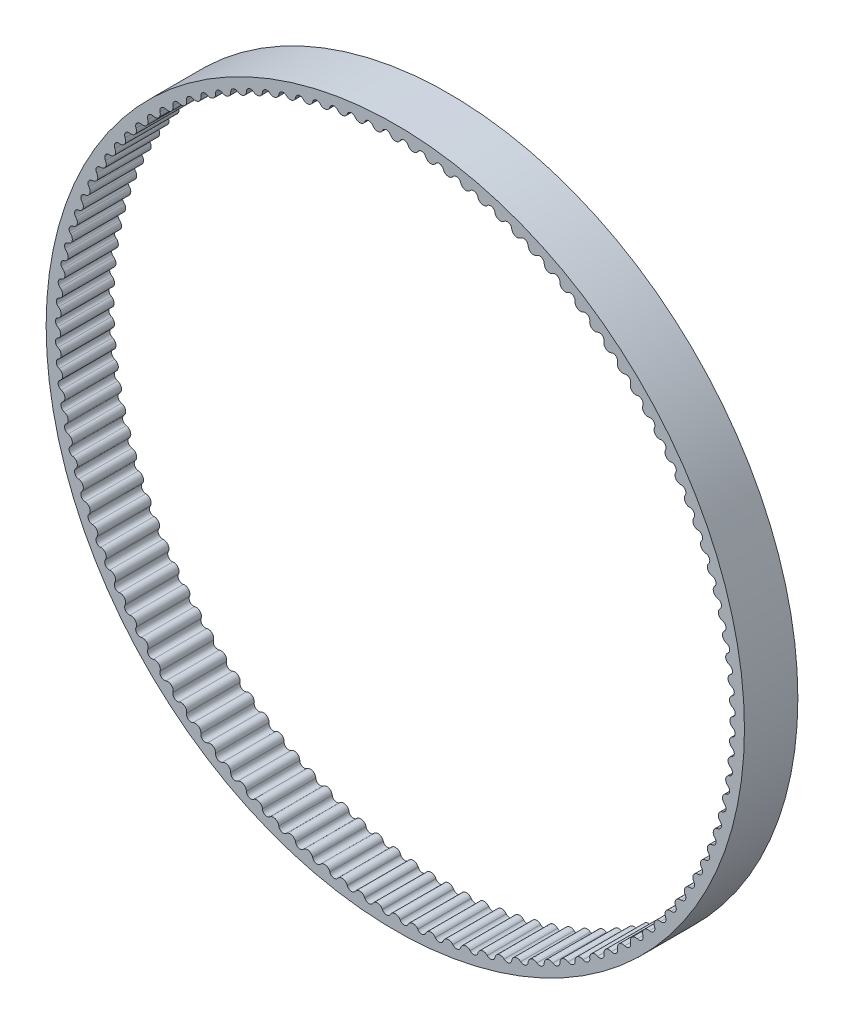
from build123d import *

# Parameters (mm, degrees)
SKETCH2_R           = 39.227218606
SKETCH2_R_2         = 37.587218606
BOSS_EXTRUDE1_DEPTH = 3
CUT_EXTRUDE1_DEPTH  = 56.556721997
CIRPATTERN3_COUNT   = 120


with BuildPart() as part:
    # Sketch2 → Boss-Extrude1 (new, symmetric)
    with BuildSketch(Plane.XY):
        Circle(SKETCH2_R)
        Circle(SKETCH2_R_2, mode=Mode.SUBTRACT)
    extrude(amount=BOSS_EXTRUDE1_DEPTH, both=True)

    # Sketch3 → Cut-Extrude1 (cut, symmetric)
    with BuildSketch(Plane.XY):
        with BuildLine():
            ThreePointArc((1.967163028, 37.535706629), (0.983918678, 37.574338405), (0, 37.587218606))
            ThreePointArc((0, 37.587218606), (0.315809817, 37.675333408), (0.540381865, 37.914221361))
            ThreePointArc((0.540381865, 37.914221361), (0.999886617, 38.184129373), (1.44463574, 37.89054264))
            ThreePointArc((1.44463574, 37.89054264), (1.65639759, 37.640228882), (1.967163028, 37.535706629))
        make_face()
    cut_extrude1 = extrude(amount=CUT_EXTRUDE1_DEPTH, both=True, mode=Mode.SUBTRACT)

    # CirPattern3: Cut-Extrude1 ×120 about axis
    cirpattern3_axis = Axis((0, 0, 3), (0, 0, -1))
    for i in range(1, CIRPATTERN3_COUNT):
        add(cut_extrude1.rotate(cirpattern3_axis, i * 360 / CIRPATTERN3_COUNT), mode=Mode.SUBTRACT)


solid = part.part
